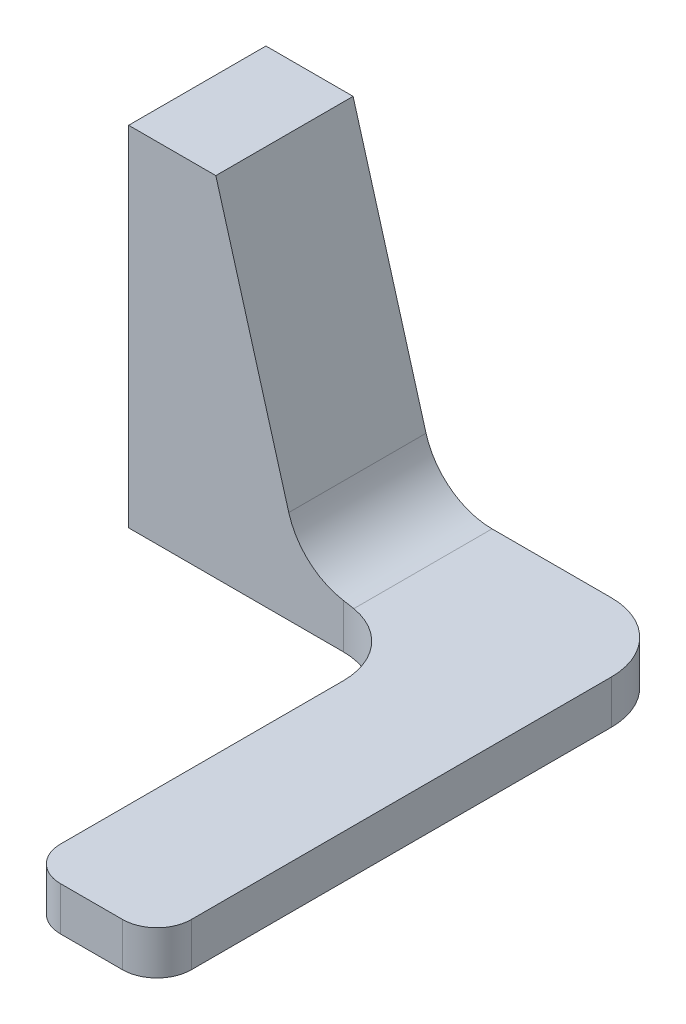
from build123d import *

# Parameters (mm, degrees)
BOSS_EXTRUDE2_DEPTH     = 50.8
CUT_EXTRUDE1_DEPTH      = 103.966915196
CUT_EXTRUDE1_DEPTH_BACK = 103.966915196
FILLET1_R               = 10
FILLET2_R               = 10
FILLET3_R               = 5


with BuildPart() as part:
    # Sketch2 → Boss-Extrude2 (new body)
    with BuildSketch(Plane(origin=(0, 0, 0), x_dir=(1, 0, 0), z_dir=(0, 1, 0))):
        Polygon((0, -10), (0, 10), (60.325, 10), (60.325, -66.2), (41.275, -66.2), (41.275, -10), align=None)
    extrude(amount=BOSS_EXTRUDE2_DEPTH)

    # Sketch3 → Cut-Extrude1 (cut, two sides: drawn at the far end of the back side and taken through both)
    with BuildSketch(Plane.XY.offset(-CUT_EXTRUDE1_DEPTH_BACK)):
        Polygon((12.7, 50.8), (25.4, 6.35), (60.325, 6.35), (60.325, 50.8), align=None)
    extrude(amount=CUT_EXTRUDE1_DEPTH + CUT_EXTRUDE1_DEPTH_BACK, mode=Mode.SUBTRACT)

    # Fillet1
    fillet1_edges = [part.edges().sort_by_distance(p)[0] for p in [
        (25.4, 6.35, 0),
    ]]
    fillet(fillet1_edges, radius=FILLET1_R)

    # Fillet2
    fillet2_edges = [part.edges().sort_by_distance(p)[0] for p in [
        (60.325, 3.175, -10),
        (41.275, 3.175, 10),
    ]]
    fillet(fillet2_edges, radius=FILLET2_R)

    # Fillet3
    fillet3_edges = [part.edges().sort_by_distance(p)[0] for p in [
        (60.325, 3.175, 66.2),
        (41.275, 3.175, 66.2),
    ]]
    fillet(fillet3_edges, radius=FILLET3_R)


solid = part.part
